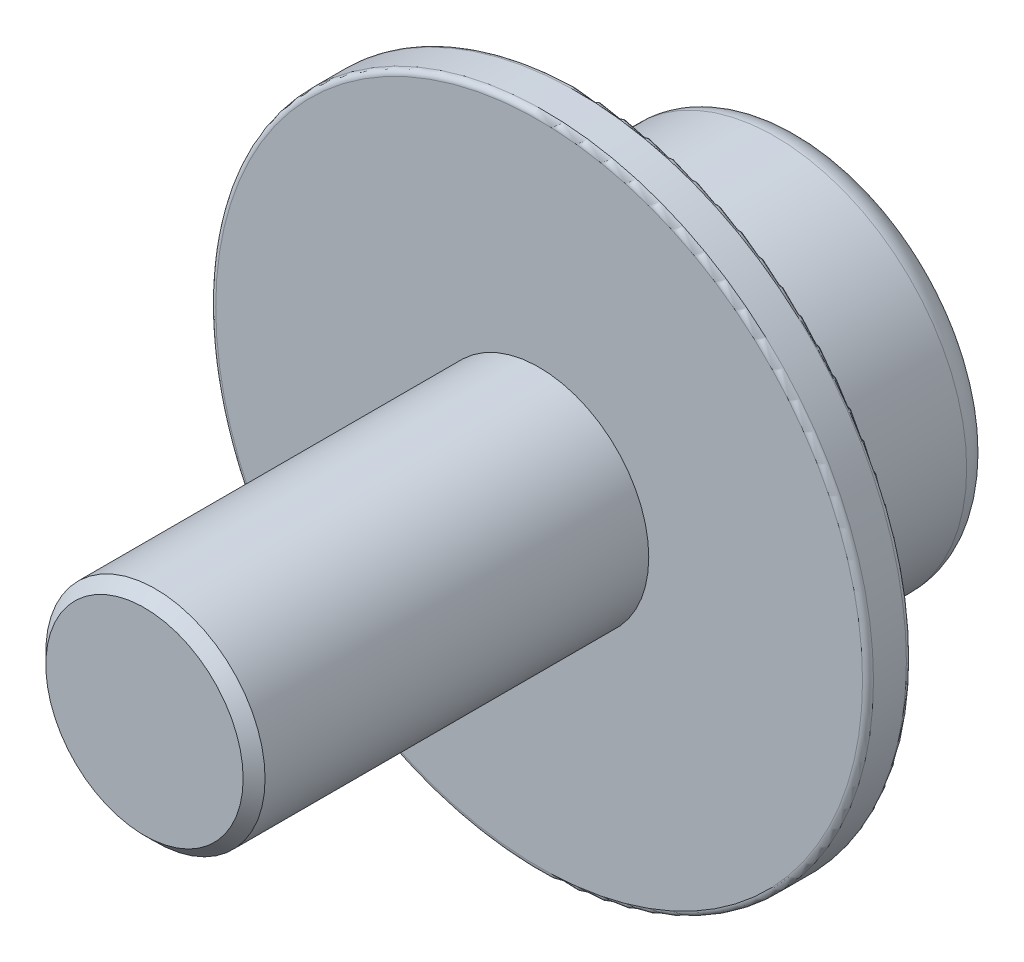
from build123d import *

# Parameters (mm, degrees)
SKETCH1_R           = 3.5
BOSS_EXTRUDE1_DEPTH = 4
SKETCH2_R           = 2
BOSS_EXTRUDE2_DEPTH = 8
CUT_EXTRUDE1_DEPTH  = 2.5
FILLET1_R           = 0.5
CHAMFER1_SIZE       = 0.2
SKETCH4_R           = 6
BOSS_EXTRUDE3_DEPTH = 0.8
FILLET2_R           = 0.1


with BuildPart() as part:
    # Sketch1 → Boss-Extrude1 (new body)
    with BuildSketch(Plane.XY):
        Circle(SKETCH1_R)
    extrude(amount=BOSS_EXTRUDE1_DEPTH)

    # Sketch2 → Boss-Extrude2 (add)
    with BuildSketch(Plane.XY.offset(4)):
        Circle(SKETCH2_R)
    extrude(amount=BOSS_EXTRUDE2_DEPTH)

    # Sketch3 → Cut-Extrude1 (cut)
    with BuildSketch(Plane(origin=(0, 0, 0), x_dir=(-1, 0, 0), z_dir=(0, 0, -1))):
        Polygon((2.020725942, 0), (1.010362971, 1.75), (-1.010362971, 1.75), (-2.020725942, 0), (-1.010362971, -1.75), (1.010362971, -1.75), align=None)
    extrude(amount=-CUT_EXTRUDE1_DEPTH, mode=Mode.SUBTRACT)

    # Fillet1
    fillet1_edges = [part.edges().sort_by_distance(p)[0] for p in [
        (-1.515544457, -0.875, 0),
        (-1.515544457, 0.875, 0),
        (0, 1.75, 0),
        (1.515544457, 0.875, 0),
        (1.515544457, -0.875, 0),
        (0, -1.75, 0),
        (-3.5, 0, 0),
        (-3.5, 0, 4),
        (-2, 0, 4),
    ]]
    fillet(fillet1_edges, radius=FILLET1_R)

    # Chamfer1
    chamfer1_edges = [part.edges().sort_by_distance(p)[0] for p in [
        (-2, 0, 12),
    ]]
    chamfer(chamfer1_edges, length=CHAMFER1_SIZE)

    # Sketch4 → Boss-Extrude3 (add)
    with BuildSketch(Plane.XY.offset(4)):
        Circle(SKETCH4_R)
    extrude(amount=BOSS_EXTRUDE3_DEPTH)

    # Fillet2
    fillet2_edges = [part.edges().sort_by_distance(p)[0] for p in [
        (-6, 0, 4),
        (-6, 0, 4.8),
    ]]
    fillet(fillet2_edges, radius=FILLET2_R)


solid = part.part
